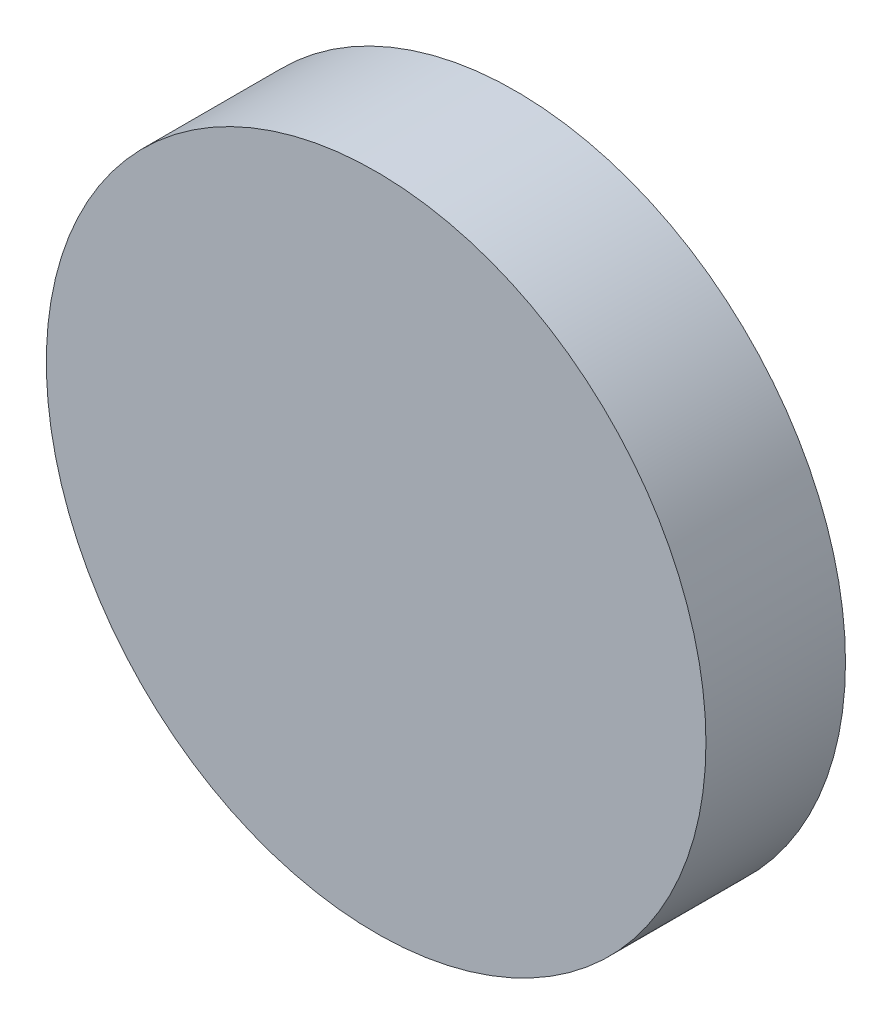
from build123d import *

# Parameters (mm, degrees)
SKETCH1_R           = 78
BOSS_EXTRUDE1_DEPTH = 33


with BuildPart() as part:
    # Sketch1 → Boss-Extrude1 (new body)
    with BuildSketch(Plane.XY):
        Circle(SKETCH1_R)
    extrude(amount=BOSS_EXTRUDE1_DEPTH)


solid = part.part
